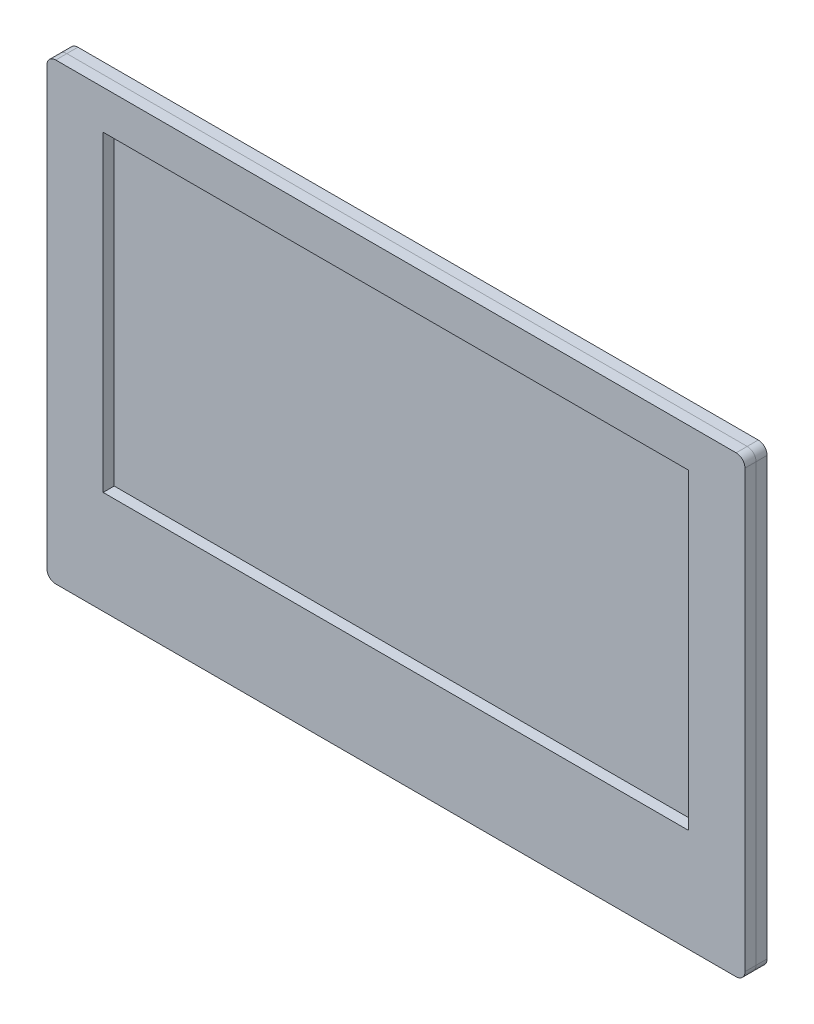
from build123d import *

# Parameters (mm, degrees)
SKETCH1_W           = 200.230919124
SKETCH1_H           = 130.164702166
SKETCH1_W_2         = 167.9702
SKETCH1_H_2         = 89.484454
BOSS_EXTRUDE1_DEPTH = 1.5875
FILLET1_R           = 2.54
BOSS_EXTRUDE2_DEPTH = 3.175


with BuildPart() as part:
    # Sketch1 → Boss-Extrude1 (new, symmetric)
    with BuildSketch(Plane.XY):
        with Locations((0, -9.199836276)):
            Rectangle(SKETCH1_W, SKETCH1_H)
        Rectangle(SKETCH1_W_2, SKETCH1_H_2, mode=Mode.SUBTRACT)
    extrude(amount=BOSS_EXTRUDE1_DEPTH, both=True)

    # Fillet1
    fillet1_edges = [part.edges().sort_by_distance(p)[0] for p in [
        (-100.115459562, 55.882514807, 0),
        (100.115459562, 55.882514807, 0),
        (100.115459562, -74.282187359, 0),
        (-100.115459562, -74.282187359, 0),
    ]]
    fillet(fillet1_edges, radius=FILLET1_R)


with BuildPart() as body_2:
    # Sketch2 → Boss-Extrude2 (new body)
    with BuildSketch(Plane(origin=(0, 0, -1.5875), x_dir=(-1, 0, 0), z_dir=(0, 0, -1))):
        with BuildLine():
            Line((100.115459562, -71.742187359), (100.115459562, 53.342514807))
            ThreePointArc((100.115459562, 53.342514807), (99.371510786, 55.138566032), (97.575459562, 55.882514807))
            Line((97.575459562, 55.882514807), (-97.575459562, 55.882514807))
            ThreePointArc((-97.575459562, 55.882514807), (-99.371510786, 55.138566032), (-100.115459562, 53.342514807))
            Line((-100.115459562, 53.342514807), (-100.115459562, -71.742187359))
            ThreePointArc((-100.115459562, -71.742187359), (-99.371510786, -73.538238583), (-97.575459562, -74.282187359))
            Line((-97.575459562, -74.282187359), (97.575459562, -74.282187359))
            ThreePointArc((97.575459562, -74.282187359), (99.371510786, -73.538238583), (100.115459562, -71.742187359))
        make_face()
    extrude(amount=BOSS_EXTRUDE2_DEPTH)


solid = Compound([part.part, body_2.part])
